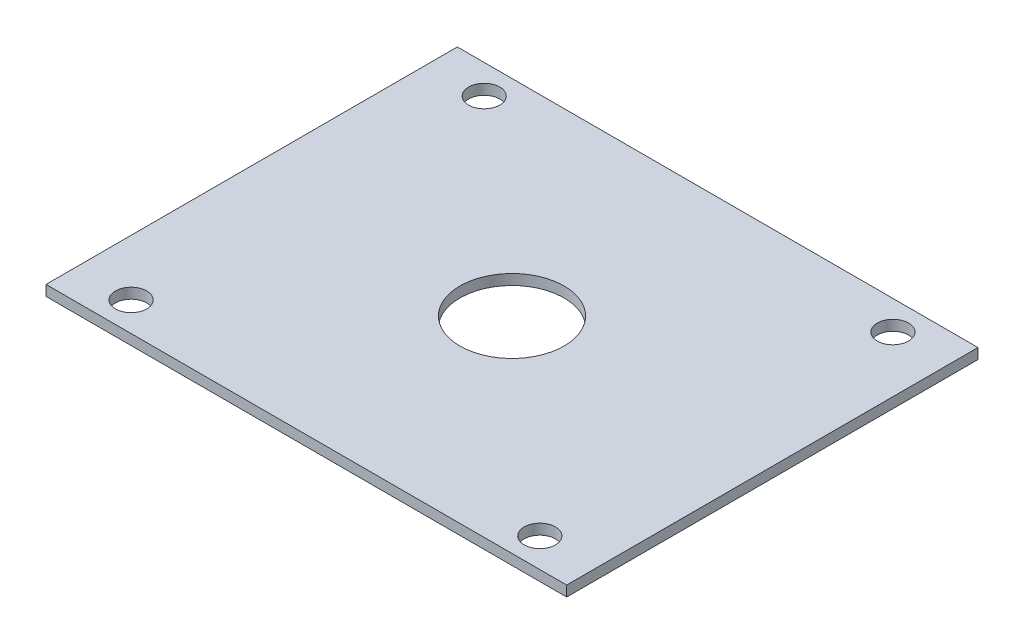
from build123d import *

# Parameters (mm, degrees)
SKETCH1_W           = 50
SKETCH1_H           = 39.5
SKETCH1_R           = 1.5
BOSS_EXTRUDE1_DEPTH = 1
SKETCH2_R           = 5
CUT_EXTRUDE1_DEPTH  = 1


with BuildPart() as part:
    # Sketch1 → Boss-Extrude1 (new body)
    with BuildSketch(Plane(origin=(0, 0, 0), x_dir=(1, 0, 0), z_dir=(0, 1, 0))):
        Rectangle(SKETCH1_W, SKETCH1_H)
        with Locations(Location((-19.625, 16.955, 0), (0, 0, 270))):
            Circle(SKETCH1_R, mode=Mode.SUBTRACT)
        with Locations(Location((-19.625, -16.955, 0), (0, 0, 270))):
            Circle(SKETCH1_R, mode=Mode.SUBTRACT)
        with Locations(Location((19.625, 16.955, 0), (0, 0, 270))):
            Circle(SKETCH1_R, mode=Mode.SUBTRACT)
        with Locations(Location((19.625, -16.955, 0), (0, 0, 270))):
            Circle(SKETCH1_R, mode=Mode.SUBTRACT)
    extrude(amount=BOSS_EXTRUDE1_DEPTH)

    # Sketch2 → Cut-Extrude1 (cut)
    with BuildSketch(Plane(origin=(0, 1, 0), x_dir=(1, 0, 0), z_dir=(0, 1, 0))):
        with Locations(Location((0, 0, 0), (0, 0, 270))):
            Circle(SKETCH2_R)
    extrude(amount=-CUT_EXTRUDE1_DEPTH, mode=Mode.SUBTRACT)


solid = part.part
